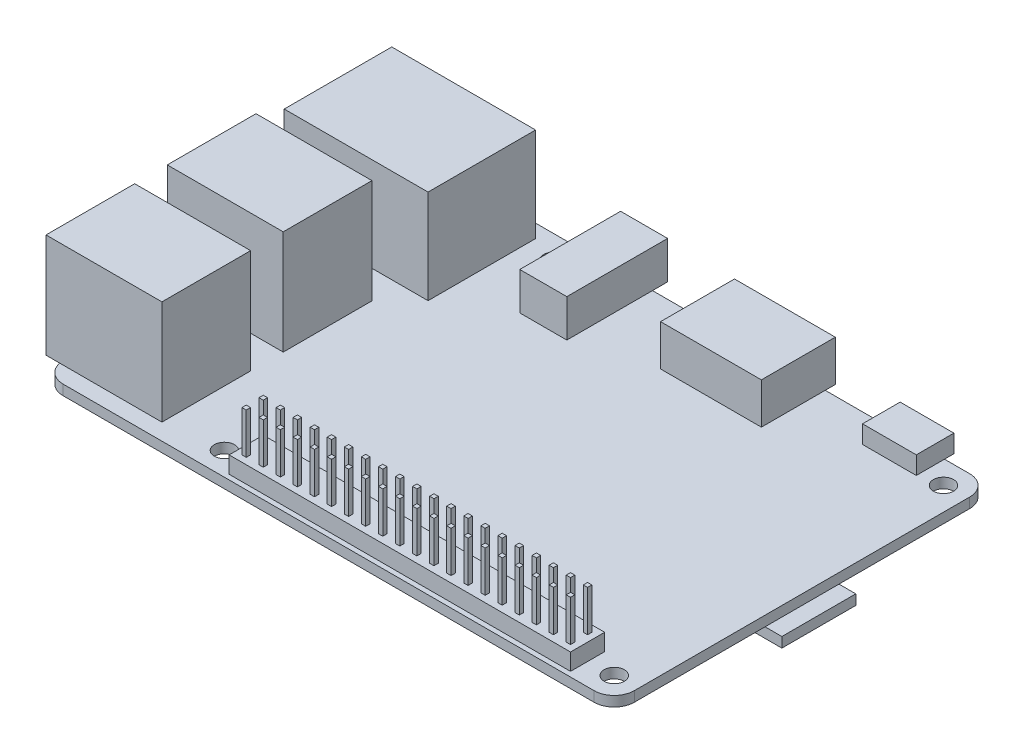
from build123d import *

# Parameters (mm, degrees)
SKETCH1_R            = 1.5
BOSS_EXTRUDE1_DEPTH  = 1.5
SKETCH2_W            = 15.5
SKETCH2_H            = 11
BOSS_EXTRUDE2_DEPTH  = 1.5
SKETCH3_W            = 21.4
SKETCH3_H            = 16
BOSS_EXTRUDE3_DEPTH  = 14
SKETCH4_W            = 17.25
SKETCH4_H            = 13.2
BOSS_EXTRUDE4_DEPTH  = 15.5
SKETCH5_W            = 15
SKETCH5_H            = 11
BOSS_EXTRUDE5_DEPTH  = 6.1
SKETCH6_W            = 7
SKETCH6_H            = 15
BOSS_EXTRUDE6_DEPTH  = 5.6
SKETCH7_W            = 8
SKETCH7_H            = 5.6
BOSS_EXTRUDE7_DEPTH  = 2.66
SKETCH8_W            = 2.54
SKETCH8_H            = 2.54
BOSS_EXTRUDE8_DEPTH  = 2.5
SKETCH8_3_W          = 0.64
SKETCH8_3_H          = 0.64
BOSS_EXTRUDE9_DEPTH  = 8.6
LPATTERN1_COUNT      = 20
LPATTERN1_PITCH      = 2.54
LPATTERN1_COUNT_DIR2 = 2
LPATTERN1_PITCH_DIR2 = 2.54


with BuildPart() as part:
    # Sketch1 → Boss-Extrude1 (new body)
    with BuildSketch(Plane(origin=(0, 0, 0), x_dir=(1, 0, 0), z_dir=(0, 1, 0))):
        with BuildLine():
            Line((-39.5, -27.95), (39.5, -27.95))
            ThreePointArc((39.5, -27.95), (41.621320344, -27.071320344), (42.5, -24.95))
            Line((42.5, -24.95), (42.5, 24.95))
            ThreePointArc((42.5, 24.95), (41.621320344, 27.071320344), (39.5, 27.95))
            Line((39.5, 27.95), (-39.5, 27.95))
            ThreePointArc((-39.5, 27.95), (-41.621320344, 27.071320344), (-42.5, 24.95))
            Line((-42.5, 24.95), (-42.5, -24.95))
            ThreePointArc((-42.5, -24.95), (-41.621320344, -27.071320344), (-39.5, -27.95))
        make_face()
        with Locations((-18.95, 24.5)):
            Circle(SKETCH1_R, mode=Mode.SUBTRACT)
        with Locations((39.05, 24.5)):
            Circle(SKETCH1_R, mode=Mode.SUBTRACT)
        with Locations((39.05, -24.5)):
            Circle(SKETCH1_R, mode=Mode.SUBTRACT)
        with Locations((-18.95, -24.5)):
            Circle(SKETCH1_R, mode=Mode.SUBTRACT)
    extrude(amount=BOSS_EXTRUDE1_DEPTH)

    # Sketch2 → Boss-Extrude2 (add)
    with BuildSketch(Plane.XZ):
        with Locations((37.25, 0)):
            Rectangle(SKETCH2_W, SKETCH2_H)
    extrude(amount=BOSS_EXTRUDE2_DEPTH)

    # Sketch3 → Boss-Extrude3 (add)
    with BuildSketch(Plane(origin=(0, 1.5, 0), x_dir=(1, 0, 0), z_dir=(0, 1, 0))):
        with Locations((-33.8, 17.95)):
            Rectangle(SKETCH3_W, SKETCH3_H)
    extrude(amount=BOSS_EXTRUDE3_DEPTH)

    # Sketch4 → Boss-Extrude4 (add)
    with BuildSketch(Plane(origin=(0, 1.5, 0), x_dir=(1, 0, 0), z_dir=(0, 1, 0))):
        with Locations((-35.875, -0.85)):
            Rectangle(SKETCH4_W, SKETCH4_H)
        with Locations((-35.875, -18.9)):
            Rectangle(SKETCH4_W, SKETCH4_H)
    extrude(amount=BOSS_EXTRUDE4_DEPTH)

    # Sketch5 → Boss-Extrude5 (add)
    with BuildSketch(Plane(origin=(0, 1.5, 0), x_dir=(1, 0, 0), z_dir=(0, 1, 0))):
        with Locations((10.5, 23.95)):
            Rectangle(SKETCH5_W, SKETCH5_H)
    extrude(amount=BOSS_EXTRUDE5_DEPTH)

    # Sketch6 → Boss-Extrude6 (add)
    with BuildSketch(Plane(origin=(0, 1.5, 0), x_dir=(1, 0, 0), z_dir=(0, 1, 0))):
        with Locations((-11.2, 22.7)):
            Rectangle(SKETCH6_W, SKETCH6_H)
    extrude(amount=BOSS_EXTRUDE6_DEPTH)

    # Sketch7 → Boss-Extrude7 (add)
    with BuildSketch(Plane(origin=(0, 1.5, 0), x_dir=(1, 0, 0), z_dir=(0, 1, 0))):
        with Locations((31.75, 26.55)):
            Rectangle(SKETCH7_W, SKETCH7_H)
    extrude(amount=BOSS_EXTRUDE7_DEPTH)

    # Sketch8 → Boss-Extrude8 (add)
    with BuildSketch(Plane(origin=(0, 1.5, 0), x_dir=(1, 0, 0), z_dir=(0, 1, 0))):
        with Locations((34, -25.95)):
            Rectangle(SKETCH8_W, SKETCH8_H)
    boss_extrude8 = extrude(amount=BOSS_EXTRUDE8_DEPTH)

    # Sketch8<3> → Boss-Extrude9 (add)
    with BuildSketch(Plane(origin=(0, 1.5, 0), x_dir=(1, 0, 0), z_dir=(0, 1, 0))):
        with Locations((34, -25.95)):
            Rectangle(SKETCH8_3_W, SKETCH8_3_H)
    boss_extrude9 = extrude(amount=BOSS_EXTRUDE9_DEPTH)

    # LPattern1: Boss-Extrude8, Boss-Extrude9 20 × 2
    with Locations(*[(-i * LPATTERN1_PITCH, 0, -j * LPATTERN1_PITCH_DIR2) for i in range(LPATTERN1_COUNT) for j in range(LPATTERN1_COUNT_DIR2) if (i, j) != (0, 0)]):
        add(boss_extrude8)
        add(boss_extrude9)


solid = part.part
